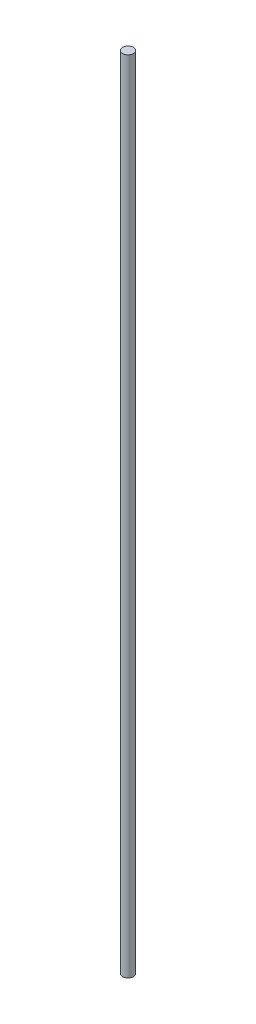
from build123d import *

# Parameters (mm, degrees)
SKETCH1_R           = 2.921
BOSS_EXTRUDE1_DEPTH = 431.8


with BuildPart() as part:
    # Sketch1 → Boss-Extrude1 (new body)
    with BuildSketch(Plane(origin=(0, 0, 0), x_dir=(1, 0, 0), z_dir=(0, 1, 0))):
        with Locations(Location((0, 0, 0), (0, 0, 270))):
            Circle(SKETCH1_R)
    extrude(amount=BOSS_EXTRUDE1_DEPTH)


solid = part.part
